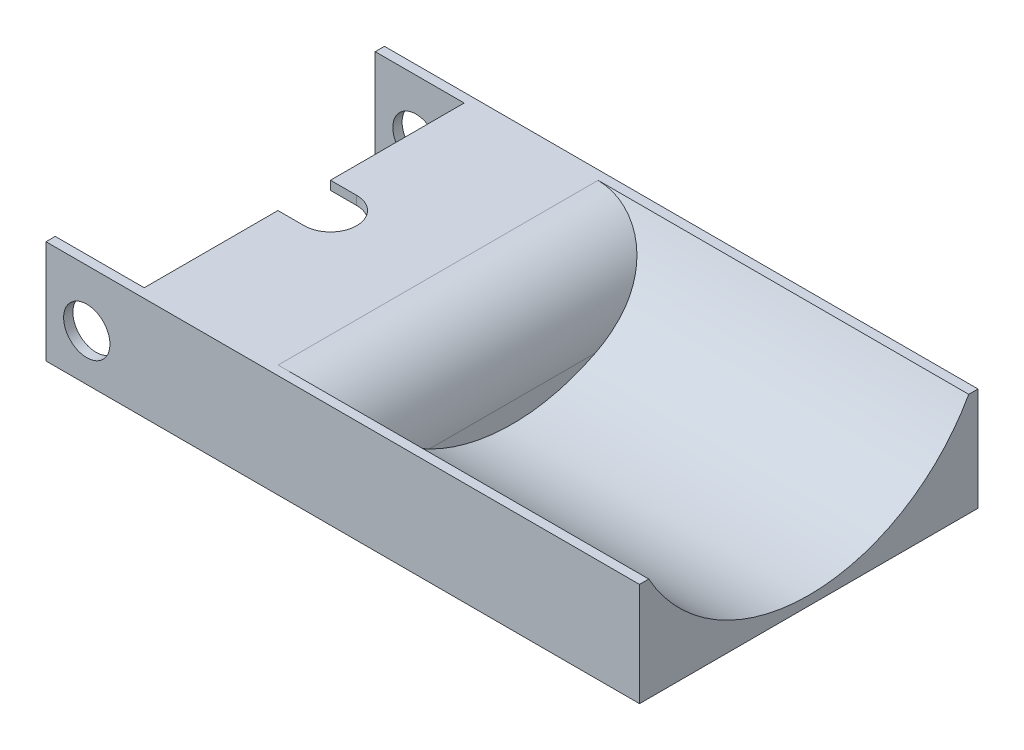
from build123d import *

# Parameters (mm, degrees)
SKETCH1_W                = 57.9882
SKETCH1_H                = 17.70126
BOSS_EXTRUDE1_DEPTH      = 101.681600523
SKETCH5_W                = 15.24
SKETCH5_H                = 54.8132
CUT_EXTRUDE1_DEPTH       = 127
SKETCH6_R                = 4.49961
CUT_EXTRUDE2_DEPTH       = 127
CUT_EXTRUDE13_DEPTH      = 50.8
FILLET5_R                = 12.7
SKETCH14_R               = 3.96875
CUT_EXTRUDE14_DEPTH      = 88.9
CUT_EXTRUDE16_DEPTH      = 108.20606489
CUT_EXTRUDE16_DEPTH_BACK = 16.1925


with BuildPart() as part:
    # Sketch1 → Boss-Extrude1 (new body)
    with BuildSketch(Plane(origin=(0, 0, 0), x_dir=(0, 0, -1), z_dir=(1, 0, 0))):
        Rectangle(SKETCH1_W, SKETCH1_H)
    extrude(amount=BOSS_EXTRUDE1_DEPTH)

    # Sketch5 → Cut-Extrude1 (cut)
    with BuildSketch(Plane(origin=(0, 8.85063, 0), x_dir=(1, 0, 0), z_dir=(0, 1, 0))):
        with Locations((7.62, 0)):
            Rectangle(SKETCH5_W, SKETCH5_H)
    extrude(amount=-CUT_EXTRUDE1_DEPTH, mode=Mode.SUBTRACT)

    # Sketch6 → Cut-Extrude2 (cut)
    with BuildSketch(Plane(origin=(0, 8.85063, 0), x_dir=(1, 0, 0), z_dir=(0, 1, 0))):
        with BuildLine():
            ThreePointArc((15.24, 0), (16.557905256, 3.181704744), (19.73961, 4.49961))
            Line((19.73961, 4.49961), (15.24, 4.49961))
            Line((15.24, 4.49961), (15.24, 0))
        make_face()
        with Locations((19.73961, 0)):
            Circle(SKETCH6_R)
        with BuildLine():
            ThreePointArc((19.73961, -4.49961), (16.557905256, -3.181704744), (15.24, 0))
            Line((15.24, 0), (15.24, -4.49961))
            Line((15.24, -4.49961), (19.73961, -4.49961))
        make_face()
    extrude(amount=-CUT_EXTRUDE2_DEPTH, mode=Mode.SUBTRACT)

    # Sketch7 → Cut-Extrude13 (cut)
    with BuildSketch(Plane(origin=(101.681600523, 0, 0), x_dir=(0, 0, -1), z_dir=(1, 0, 0))):
        with BuildLine():
            Line((27.4066, 8.85063), (-27.4066, 8.85063))
            ThreePointArc((-27.4066, 8.85063), (0, -7.26313), (27.4066, 8.85063))
        make_face()
    extrude(amount=-CUT_EXTRUDE13_DEPTH, mode=Mode.SUBTRACT)

    # Fillet5
    fillet5_edges = [part.edges().sort_by_distance(p)[0] for p in [
        (50.881600523, 8.85063, 0),
    ]]
    fillet(fillet5_edges, radius=FILLET5_R)

    # Sketch14 → Cut-Extrude14 (cut)
    with BuildSketch(Plane(origin=(0, 0, -28.9941), x_dir=(-1, 0, 0), z_dir=(0, 0, -1))):
        with Locations(Location((-6.985, -0.89027, 0), (0, 0, 90))):
            Circle(SKETCH14_R)
    extrude(amount=-CUT_EXTRUDE14_DEPTH, mode=Mode.SUBTRACT)

    # Sketch18 → Cut-Extrude16 (cut, two sides: drawn at the far end of the back side and taken through both)
    with BuildSketch(Plane.XZ.offset(8.85063).offset(-CUT_EXTRUDE16_DEPTH_BACK)):
        with BuildLine():
            Line((38.18128, -27.4066), (38.18128, 27.4066))
            Line((38.18128, 27.4066), (15.24, 27.4066))
            Line((15.24, 27.4066), (15.24, 4.49961))
            Line((15.24, 4.49961), (19.73961, 4.49961))
            ThreePointArc((19.73961, 4.49961), (24.23922, 0), (19.73961, -4.49961))
            Line((19.73961, -4.49961), (15.24, -4.49961))
            Line((15.24, -4.49961), (15.24, -27.4066))
            Line((15.24, -27.4066), (38.18128, -27.4066))
        make_face()
    extrude(amount=CUT_EXTRUDE16_DEPTH + CUT_EXTRUDE16_DEPTH_BACK, mode=Mode.SUBTRACT)


solid = part.part
